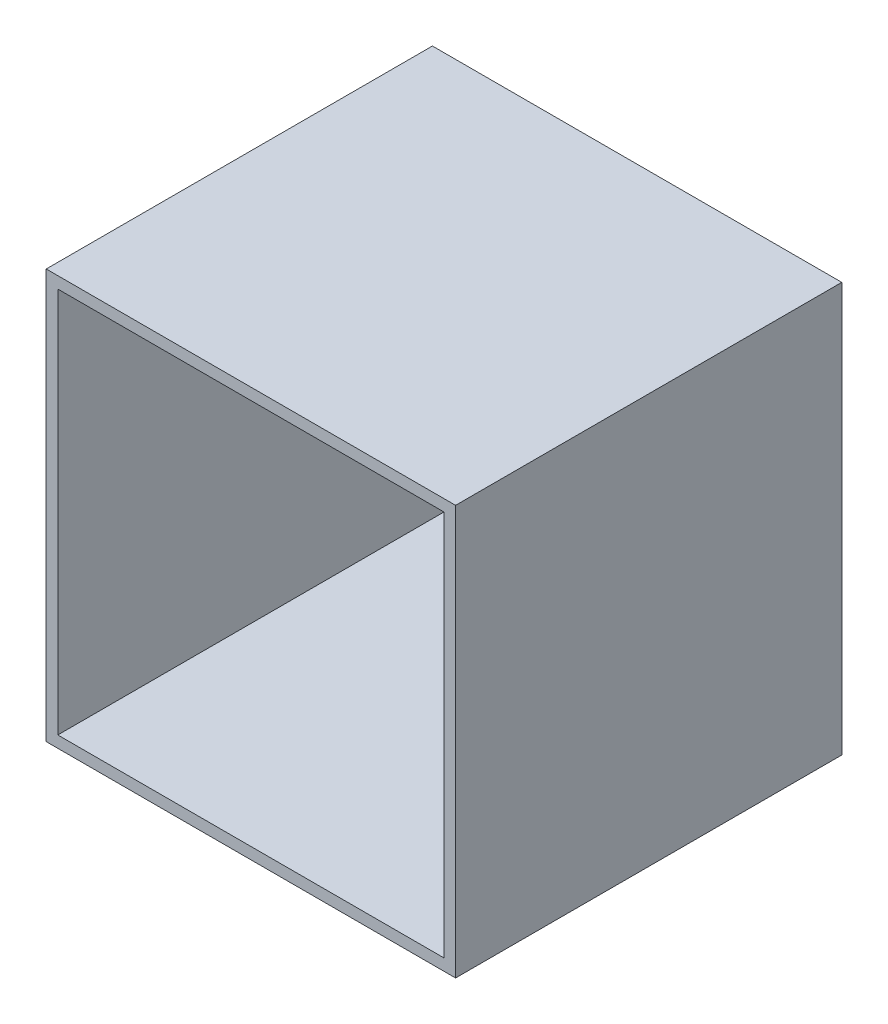
from build123d import *

# Parameters (mm, degrees)
CROQUIS1_W              = 106
CROQUIS1_H              = 106
CROQUIS1_W_2            = 100
CROQUIS1_H_2            = 100
SALIENTE_EXTRUIR1_DEPTH = 100


with BuildPart() as part:
    # Croquis1 → Saliente-Extruir1 (new body)
    with BuildSketch(Plane.XY):
        with Locations((46.912101473, -55.802516219)):
            Rectangle(CROQUIS1_W, CROQUIS1_H)
        with Locations((46.912101473, -55.802516219)):
            Rectangle(CROQUIS1_W_2, CROQUIS1_H_2, mode=Mode.SUBTRACT)
    extrude(amount=SALIENTE_EXTRUIR1_DEPTH)


solid = part.part
